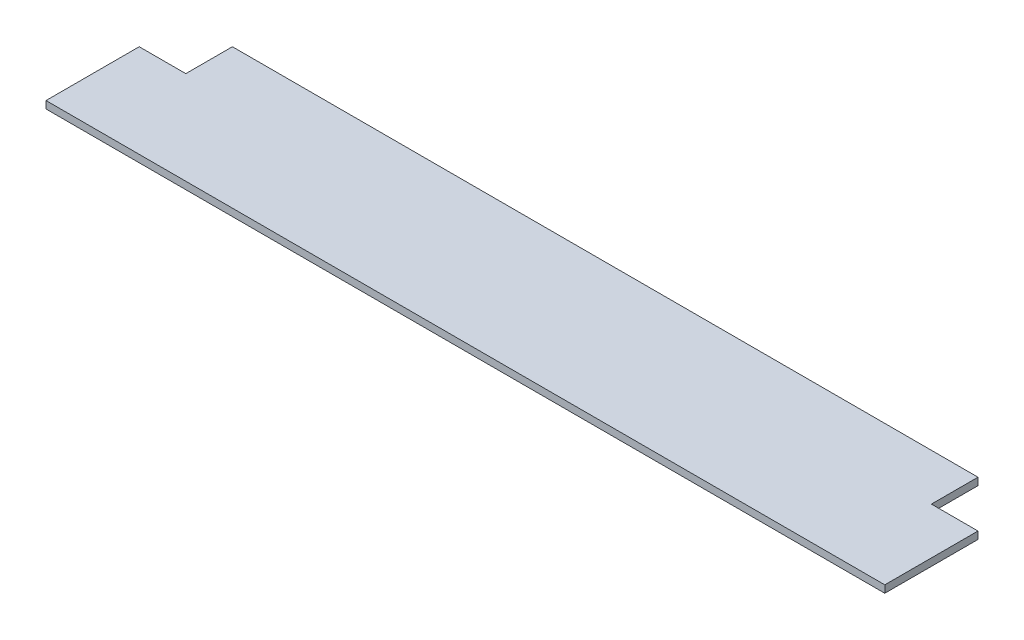
from build123d import *

# Parameters (mm, degrees)
BOSS_EXTRUDE1_DEPTH = 1


with BuildPart() as part:
    # Sketch1 → Boss-Extrude1 (new body)
    with BuildSketch(Plane(origin=(0, 0, 0), x_dir=(1, 0, 0), z_dir=(0, 1, 0))):
        Polygon((-50.8, 6.35), (-50.8, 12.7), (50.8, 12.7), (50.8, 6.35), (57.15, 6.35), (57.15, -6.35), (-57.15, -6.35), (-57.15, 6.35), align=None)
    extrude(amount=BOSS_EXTRUDE1_DEPTH)


solid = part.part
